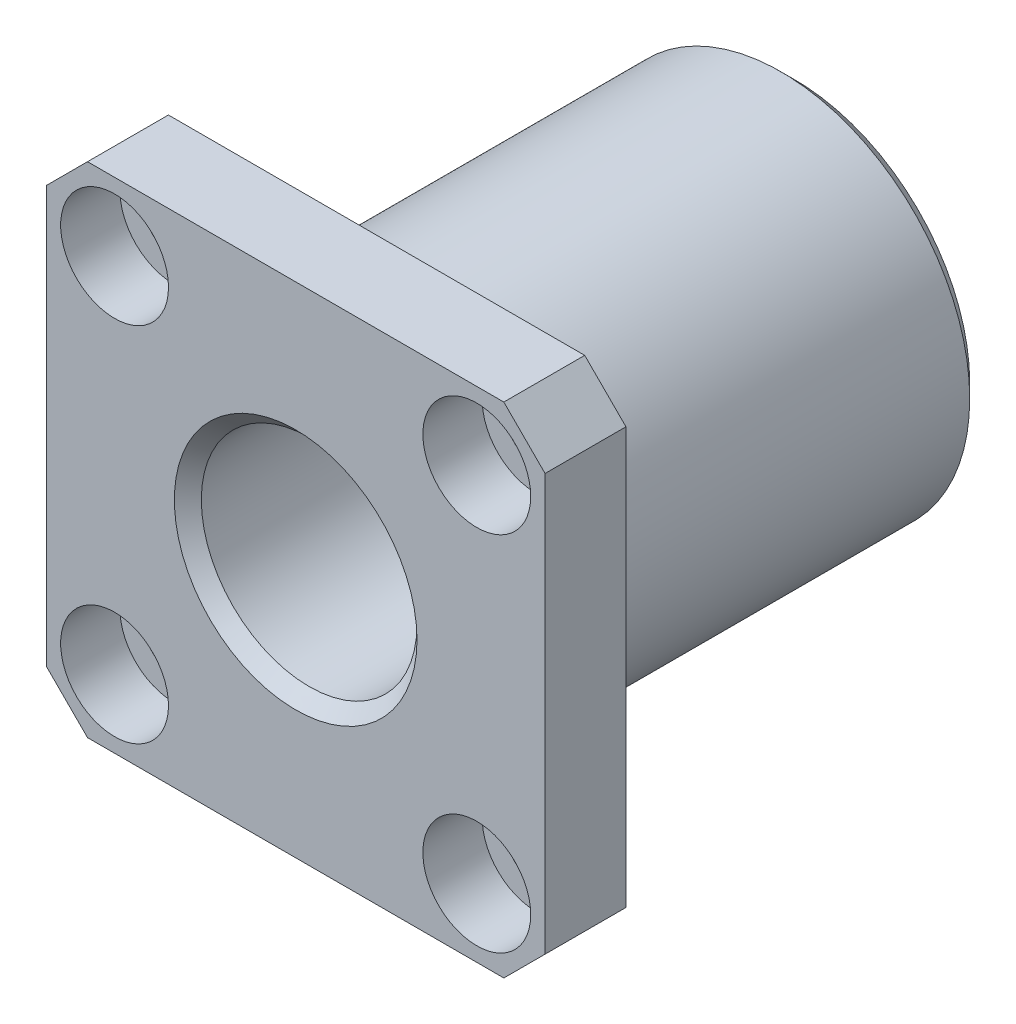
from build123d import *

# Parameters (mm, degrees)
SKETCH1_R                                           = 14
BOSS_EXTRUDE1_DEPTH                                 = 37
SKETCH2_W                                           = 37
SKETCH2_H                                           = 37
BOSS_EXTRUDE2_DEPTH                                 = 6
CUT_EXTRUDE1_DEPTH                                  = 46.315560241
CBORE_FOR_M4_HEX_SOCKET_HEAD_CAP_SCREW1_D           = 4.5
CBORE_FOR_M4_HEX_SOCKET_HEAD_CAP_SCREW1_DEPTH       = 22
CBORE_FOR_M4_HEX_SOCKET_HEAD_CAP_SCREW1_CBORE_D     = 8
CBORE_FOR_M4_HEX_SOCKET_HEAD_CAP_SCREW1_CBORE_DEPTH = 4.4
CBORE_FOR_M4_HEX_SOCKET_HEAD_CAP_SCREW1_TIP         = 1.351936393
SKETCH8_R                                           = 8
CUT_EXTRUDE2_DEPTH                                  = 46.315560241
CHAMFER1_SIZE                                       = 1


with BuildPart() as part:
    # Sketch1 → Boss-Extrude1 (new body)
    with BuildSketch(Plane.XY):
        Circle(SKETCH1_R)
    extrude(amount=BOSS_EXTRUDE1_DEPTH)

    # Sketch2 → Boss-Extrude2 (add)
    with BuildSketch(Plane.XY.offset(37)):
        Rectangle(SKETCH2_W, SKETCH2_H)
    extrude(amount=-BOSS_EXTRUDE2_DEPTH)

    # Sketch4 → Cut-Extrude1 (cut, through all)
    with BuildSketch(Plane.XY.offset(37)):
        Polygon((-18.5, 18.5), (-18.5, 15.441125497), (-15.441125497, 18.5), align=None)
        Polygon((15.441125497, 18.5), (18.5, 18.5), (18.5, 15.441125497), align=None)
        Polygon((18.5, -18.5), (18.5, -15.441125497), (15.441125497, -18.5), align=None)
        Polygon((-15.441125497, -18.5), (-18.5, -18.5), (-18.5, -15.441125497), align=None)
    extrude(amount=-CUT_EXTRUDE1_DEPTH, mode=Mode.SUBTRACT)

    # CBORE for M4 Hex Socket Head Cap Screw1
    with Locations(Plane.XY.offset(37)):
        with Locations((-13.435028843, 13.435028843), (13.435028843, 13.435028843), (13.435028843, -13.435028843), (-13.435028843, -13.435028843)):
            CounterBoreHole(CBORE_FOR_M4_HEX_SOCKET_HEAD_CAP_SCREW1_D / 2, CBORE_FOR_M4_HEX_SOCKET_HEAD_CAP_SCREW1_CBORE_D / 2, CBORE_FOR_M4_HEX_SOCKET_HEAD_CAP_SCREW1_CBORE_DEPTH, depth=CBORE_FOR_M4_HEX_SOCKET_HEAD_CAP_SCREW1_DEPTH)
            with Locations((0, 0, -(CBORE_FOR_M4_HEX_SOCKET_HEAD_CAP_SCREW1_DEPTH + CBORE_FOR_M4_HEX_SOCKET_HEAD_CAP_SCREW1_TIP / 2))):  # 118° drill point
                Cone(0, CBORE_FOR_M4_HEX_SOCKET_HEAD_CAP_SCREW1_D / 2, CBORE_FOR_M4_HEX_SOCKET_HEAD_CAP_SCREW1_TIP, mode=Mode.SUBTRACT)

    # Sketch8 → Cut-Extrude2 (cut, through all)
    with BuildSketch(Plane.XY.offset(37)):
        Circle(SKETCH8_R)
    extrude(amount=-CUT_EXTRUDE2_DEPTH, mode=Mode.SUBTRACT)

    # Chamfer1
    chamfer1_edges = [part.edges().sort_by_distance(p)[0] for p in [
        (-8, 0, 37),
        (-14, 0, 0),
    ]]
    chamfer(chamfer1_edges, length=CHAMFER1_SIZE)


solid = part.part
